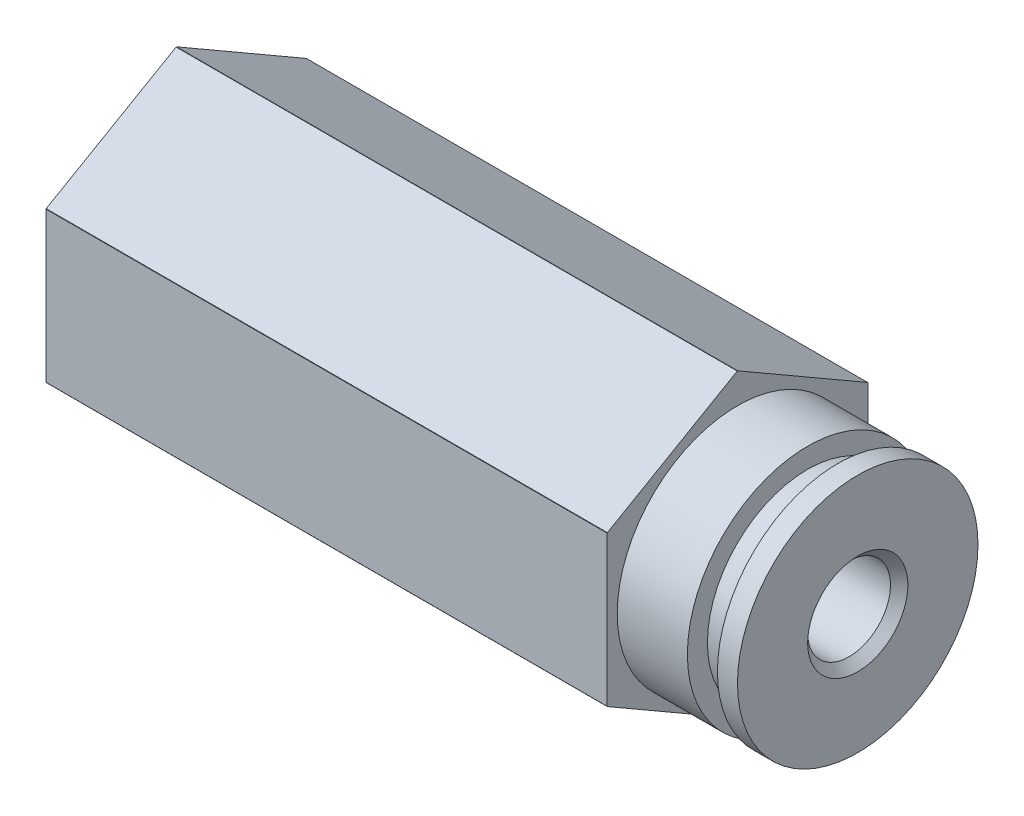
from build123d import *

# Parameters (mm, degrees)
SKETCH_4_R          = 23.958779716
CUT_EXTRUDE_1_DEPTH = 28
SKETCH_5_R          = 0.4
CUT_EXTRUDE_2_DEPTH = 3


with BuildPart() as part:
    # 草图1 → 旋转1 (revolve)
    with BuildSketch(Plane.XY, mode=Mode.PRIVATE) as revolve_1_sk:
        Polygon((0, 0), (0, 7.5), (28, 7.5), (28, 6), (31.5, 6), (31.5, 5), (33, 5), (33, 6), (34, 6), (34, 0), align=None)
    revolve(revolve_1_sk.sketch.rotate(Axis((34, 0, 0), (-1, 0, 0)), 270), axis=Axis((34, 0, 0), (-1, 0, 0)))

    # 草图2 → 切除-旋转1 (revolve, cut)
    with BuildSketch(Plane.XY, mode=Mode.PRIVATE) as cut_revolve_1_sk:
        Polygon((0, 0), (0, 2.5), (6.5, 2.5), (6.5, 5), (23.5, 5), (23.5, 0), align=None)
    revolve(cut_revolve_1_sk.sketch.rotate(Axis((23.5, 0, 0), (-1, 0, 0)), 270), axis=Axis((23.5, 0, 0), (-1, 0, 0)), mode=Mode.SUBTRACT)

    # 草图3 → 切除-旋转2 (revolve, cut)
    with BuildSketch(Plane.XY, mode=Mode.PRIVATE) as cut_revolve_2_sk:
        Polygon((27.806616994, 0), (29, 2.067), (33.567, 2.067), (34, 2.5), (34, 0), align=None)
    revolve(cut_revolve_2_sk.sketch.rotate(Axis((34, 0, 0), (-1, 0, 0)), 270), axis=Axis((34, 0, 0), (-1, 0, 0)), mode=Mode.SUBTRACT)

    # 草图4 → 切除-拉伸1 (cut)
    with BuildSketch(Plane(origin=(0, 0, 0), x_dir=(0, 0, -1), z_dir=(1, 0, 0))):
        Circle(SKETCH_4_R)
        Polygon((-6.5, -3.75277675), (0, -7.505553499), (6.5, -3.75277675), (6.5, 3.75277675), (0, 7.505553499), (-6.5, 3.75277675), align=None, mode=Mode.SUBTRACT)
    extrude(amount=CUT_EXTRUDE_1_DEPTH, mode=Mode.SUBTRACT)

    # 草图5 → 切除-拉伸2 (cut)
    with BuildSketch(Plane(origin=(0, 0, 0), x_dir=(0, 0, -1), z_dir=(1, 0, 0))):
        with Locations((0, 4)):
            Circle(SKETCH_5_R)
    extrude(amount=CUT_EXTRUDE_2_DEPTH, mode=Mode.SUBTRACT)


solid = part.part
